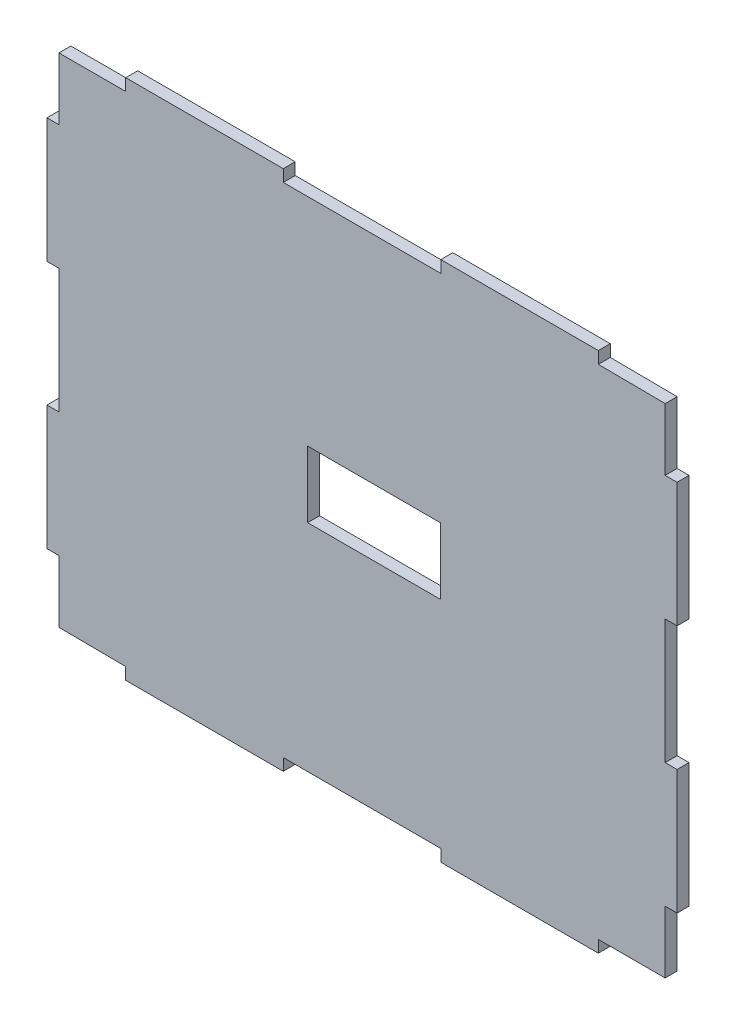
from build123d import *

# Parameters (mm, degrees)
EXTRUDE_1_DEPTH     = 3.6
SKETCH_2_W          = 40
SKETCH_2_H          = 20
CUT_EXTRUDE_1_DEPTH = 10


with BuildPart() as part:
    # 草图1 → 凸台-拉伸1 (new body)
    with BuildSketch(Plane.XY):
        Polygon((-95, 75.172935312), (-74.85, 75.172935312), (-74.85, 78.772935312), (-27.35, 78.772935312), (-27.35, 75.172935312), (20.15, 75.172935312), (20.15, 78.772935312), (67.65, 78.772935312), (67.65, 75.172935312), (87.799257887, 75), (87.799257887, 56.25), (91.399257887, 56.25), (91.399257887, 18.75), (87.799257887, 18.75), (87.799257887, -18.75), (91.399257887, -18.75), (91.399257887, -56.25), (87.799257887, -56.25), (87.799257887, -75), (67.65, -75), (67.65, -78.6), (20.15, -78.6), (20.15, -75), (-27.35, -75), (-27.35, -78.6), (-74.85, -78.6), (-74.85, -75), (-94.999257886, -74.827064673), (-95, -56.077064688), (-98.6, -56.077064688), (-98.6, -18.577064688), (-95, -18.577064688), (-95, 18.922935312), (-98.6, 18.922935312), (-98.6, 56.422935312), (-95, 56.422935312), align=None)
    extrude(amount=EXTRUDE_1_DEPTH)

    # 草图2 → 切除-拉伸1 (cut)
    with BuildSketch(Plane(origin=(0, 0, 0), x_dir=(-1, 0, 0), z_dir=(0, 0, -1))):
        Rectangle(SKETCH_2_W, SKETCH_2_H)
    extrude(amount=-CUT_EXTRUDE_1_DEPTH, mode=Mode.SUBTRACT)


solid = part.part
